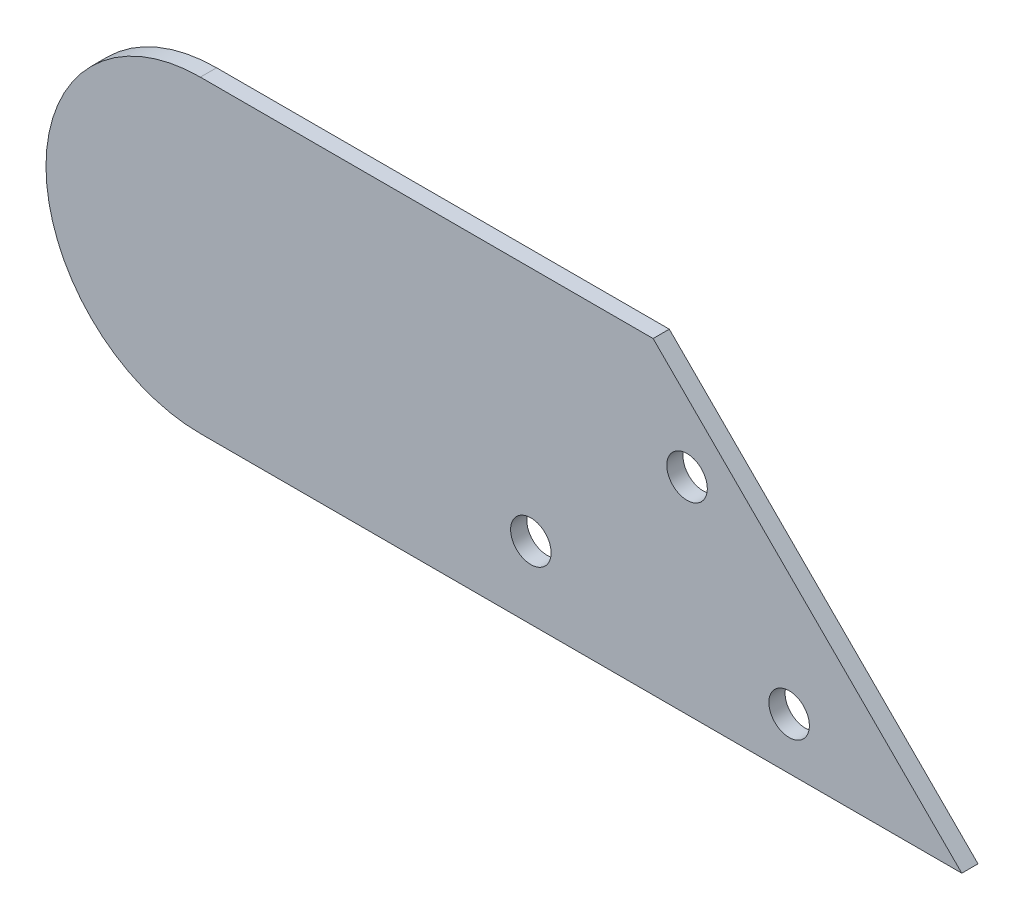
from build123d import *

# Parameters (mm, degrees)
BOSS_EXTRUDE1_DEPTH     = 2
CUT_EXTRUDE1_DEPTH      = 120.295393457
CUT_EXTRUDE1_DEPTH_BACK = 120.295393457
SKETCH2_R               = 2.5


with BuildPart() as part:
    # Sketch1 → Boss-Extrude1 (new body)
    with BuildSketch(Plane.XY):
        with BuildLine():
            Line((0, 0), (-38.1, 38.1))
            Line((-38.1, 38.1), (-93.98, 38.1))
            ThreePointArc((-93.98, 38.1), (-113.03, 19.05), (-93.98, 0))
            Line((-93.98, 0), (0, 0))
        make_face()
    extrude(amount=BOSS_EXTRUDE1_DEPTH)

    # Sketch2 → Cut-Extrude1 (cut, two sides: drawn at the far end of the back side and taken through both)
    with BuildSketch(Plane.XY.offset(2).offset(-CUT_EXTRUDE1_DEPTH_BACK)):
        with Locations((-53.1876, 8.89)):
            Circle(SKETCH2_R)
        with Locations((-21.311773075, 6.35)):
            Circle(SKETCH2_R)
        with Locations((-33.909, 25.4)):
            Circle(SKETCH2_R)
    extrude(amount=CUT_EXTRUDE1_DEPTH + CUT_EXTRUDE1_DEPTH_BACK, mode=Mode.SUBTRACT)


solid = part.part
